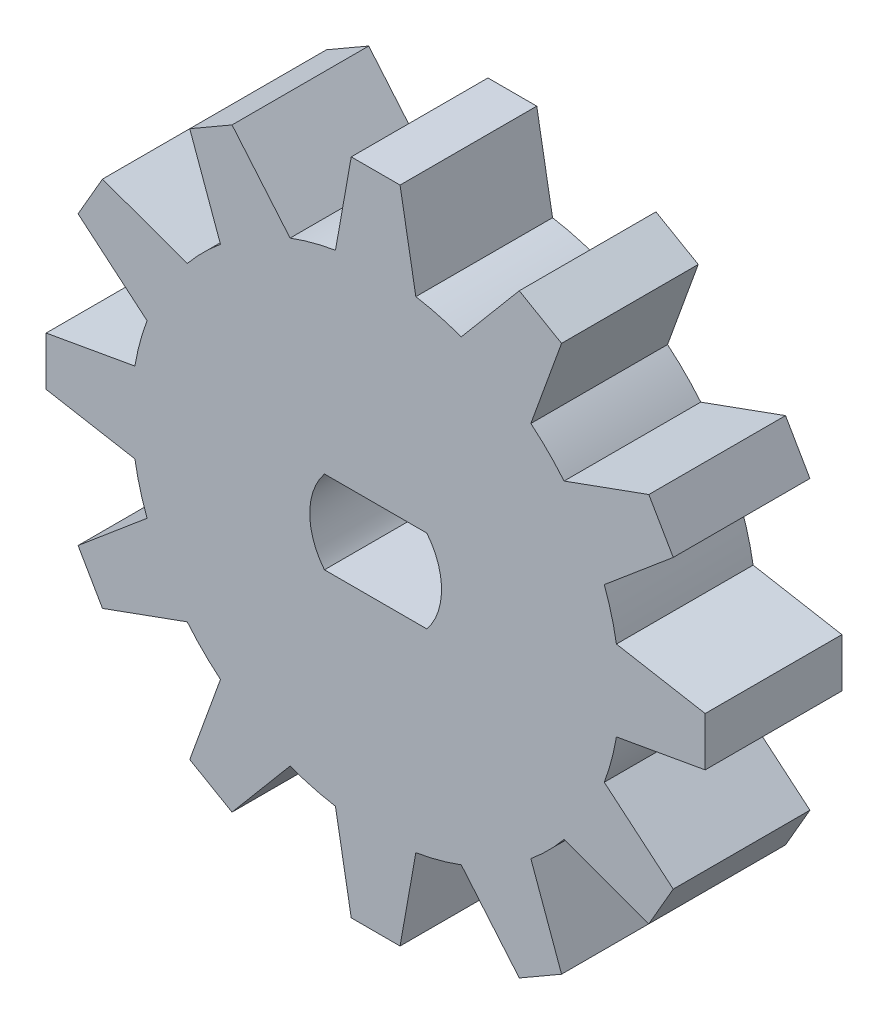
from build123d import *

# Parameters (mm, degrees)
SKETCH1_R           = 10
BOSS_EXTRUDE1_DEPTH = 5.6
BOSS_EXTRUDE2_DEPTH = 5.6
CIRPATTERN1_COUNT   = 12
CUT_EXTRUDE1_DEPTH  = 7


with BuildPart() as part:
    # Sketch1 → Boss-Extrude1 (new body)
    with BuildSketch(Plane.XY):
        Circle(SKETCH1_R)
    extrude(amount=BOSS_EXTRUDE1_DEPTH)

    # Sketch3 → Boss-Extrude2 (add)
    with BuildSketch(Plane.XY):
        Polygon((-1, 13.5), (1, 13.5), (1.8, 9), (-1.8, 9), align=None)
    boss_extrude2 = extrude(amount=BOSS_EXTRUDE2_DEPTH)

    # CirPattern1: Boss-Extrude2 ×12 about axis
    cirpattern1_axis = Axis((0, 0, 0), (0, 0, 1))
    for i in range(1, CIRPATTERN1_COUNT):
        add(boss_extrude2.rotate(cirpattern1_axis, i * 360 / CIRPATTERN1_COUNT))

    # Sketch4 → Cut-Extrude1 (cut)
    with BuildSketch(Plane.XY):
        with BuildLine():
            Line((-2.097617696, -1.7), (2.097617696, -1.7))
            ThreePointArc((2.097617696, -1.7), (2.7, 0), (2.097617696, 1.7))
            Line((2.097617696, 1.7), (-2.097617696, 1.7))
            ThreePointArc((-2.097617696, 1.7), (-2.7, 0), (-2.097617696, -1.7))
        make_face()
    extrude(amount=CUT_EXTRUDE1_DEPTH, mode=Mode.SUBTRACT)


solid = part.part
